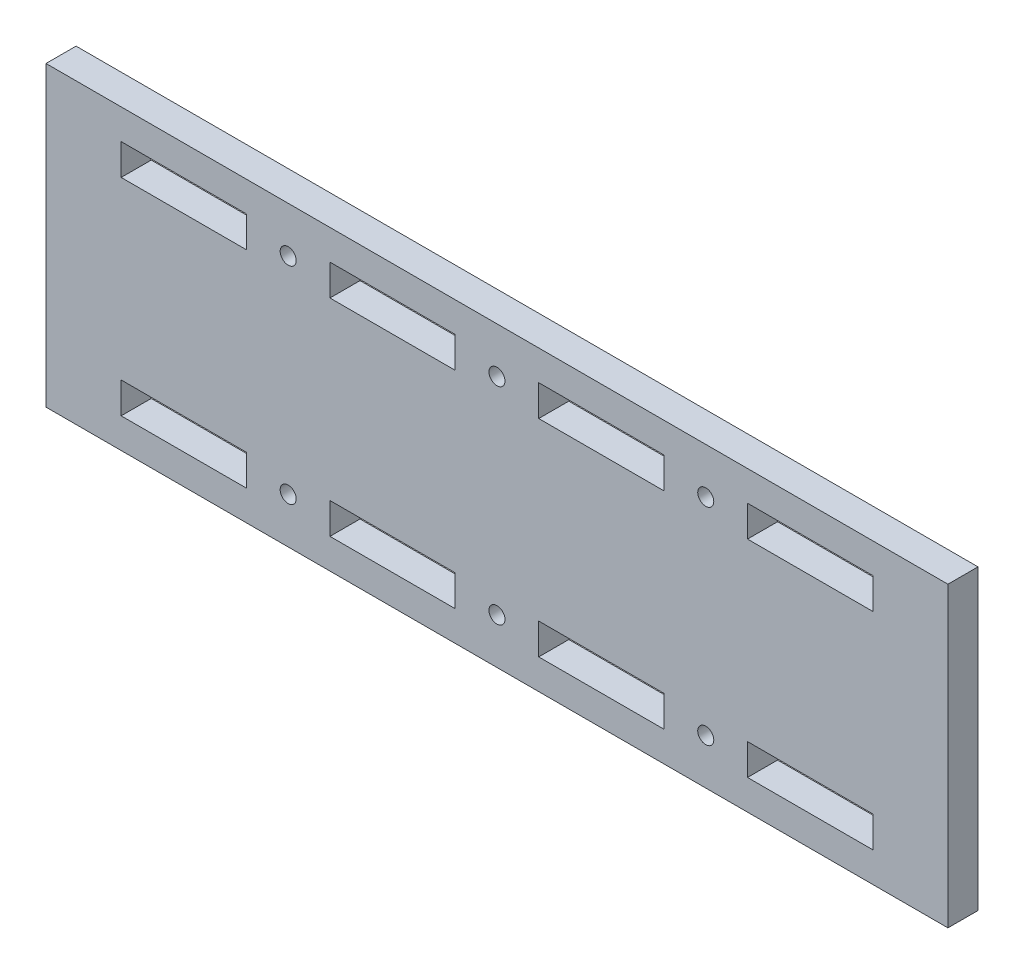
from build123d import *

# Parameters (mm, degrees)
SKETCH1_W           = 180
SKETCH1_H           = 59.4
SKETCH1_R           = 1.6
SKETCH1_W_2         = 25
SKETCH1_H_2         = 6.2
BOSS_EXTRUDE1_DEPTH = 6


with BuildPart() as part:
    # Sketch1 → Boss-Extrude1 (new body)
    with BuildSketch(Plane.XY):
        Rectangle(SKETCH1_W, SKETCH1_H)
        with Locations((-41.666666667, -20.6)):
            Circle(SKETCH1_R, mode=Mode.SUBTRACT)
        with Locations((0, -20.6)):
            Circle(SKETCH1_R, mode=Mode.SUBTRACT)
        with Locations((41.666666667, -20.6)):
            Circle(SKETCH1_R, mode=Mode.SUBTRACT)
        with Locations((0, 20.6)):
            Circle(SKETCH1_R, mode=Mode.SUBTRACT)
        with Locations((41.666666667, 20.6)):
            Circle(SKETCH1_R, mode=Mode.SUBTRACT)
        with Locations((-41.666666667, 20.6)):
            Circle(SKETCH1_R, mode=Mode.SUBTRACT)
        with Locations((-20.833333333, -20.6)):
            Rectangle(SKETCH1_W_2, SKETCH1_H_2, mode=Mode.SUBTRACT)
        with Locations((-62.5, -20.6)):
            Rectangle(SKETCH1_W_2, SKETCH1_H_2, mode=Mode.SUBTRACT)
        with Locations((20.833333333, -20.6)):
            Rectangle(SKETCH1_W_2, SKETCH1_H_2, mode=Mode.SUBTRACT)
        with Locations((62.5, -20.6)):
            Rectangle(SKETCH1_W_2, SKETCH1_H_2, mode=Mode.SUBTRACT)
        with Locations((-62.5, 20.6)):
            Rectangle(SKETCH1_W_2, SKETCH1_H_2, mode=Mode.SUBTRACT)
        with Locations((-20.833333333, 20.6)):
            Rectangle(SKETCH1_W_2, SKETCH1_H_2, mode=Mode.SUBTRACT)
        with Locations((20.833333333, 20.6)):
            Rectangle(SKETCH1_W_2, SKETCH1_H_2, mode=Mode.SUBTRACT)
        with Locations((62.5, 20.6)):
            Rectangle(SKETCH1_W_2, SKETCH1_H_2, mode=Mode.SUBTRACT)
    extrude(amount=BOSS_EXTRUDE1_DEPTH)


solid = part.part
